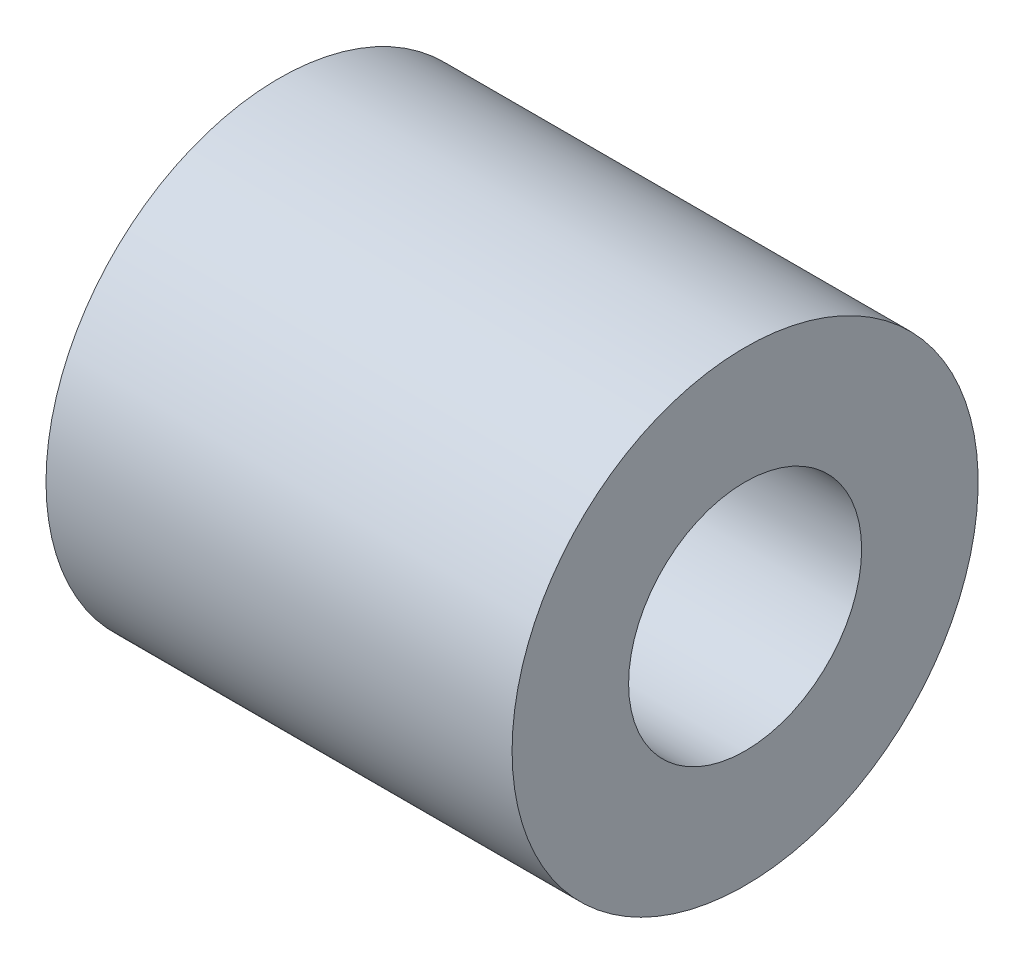
from build123d import *


with BuildPart() as part:
    # Sketch1 → Revolve1 (revolve)
    with BuildSketch(Plane(origin=(0, 0, 0), x_dir=(1, 0, 0), z_dir=(0, 1, 0)), mode=Mode.PRIVATE) as revolve1_sk:
        Polygon((0, 0), (0, 2.5), (5, 2.5), (5, 1.25), (2, 1.25), (2, 0), align=None)
    revolve(revolve1_sk.sketch.rotate(Axis((0, 0, 0), (1, 0, 0)), 180), axis=Axis((0, 0, 0), (1, 0, 0)))


solid = part.part
